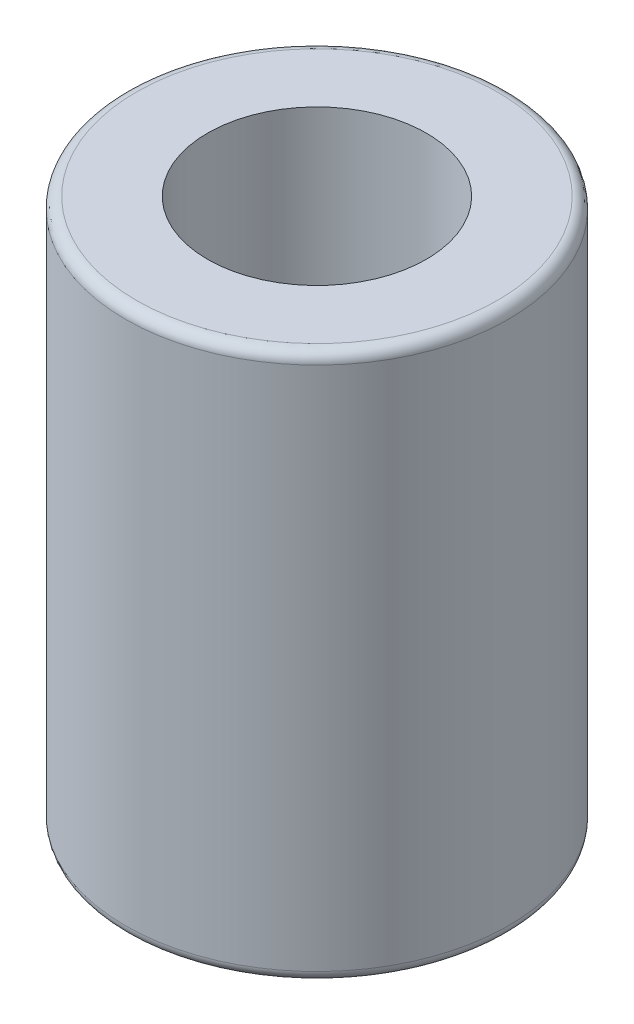
from build123d import *

# Parameters (mm, degrees)
SKETCH_1_R      = 3.5
SKETCH_1_R_2    = 2
EXTRUDE_1_DEPTH = 5
FILLET_1_R      = 0.2


with BuildPart() as part:
    # 草图1 → 凸台-拉伸1 (new, symmetric)
    with BuildSketch(Plane(origin=(0, 0, 0), x_dir=(1, 0, 0), z_dir=(0, 1, 0))):
        with Locations(Location((0, 0, 0), (0, 0, 270))):
            Circle(SKETCH_1_R)
        with Locations(Location((0, 0, 0), (0, 0, 270))):
            Circle(SKETCH_1_R_2, mode=Mode.SUBTRACT)
    extrude(amount=EXTRUDE_1_DEPTH, both=True)

    # 圆角1
    fillet_1_edges = [part.edges().sort_by_distance(p)[0] for p in [
        (0, -5, -3.5),
        (0, 5, -3.5),
    ]]
    fillet(fillet_1_edges, radius=FILLET_1_R)


solid = part.part
